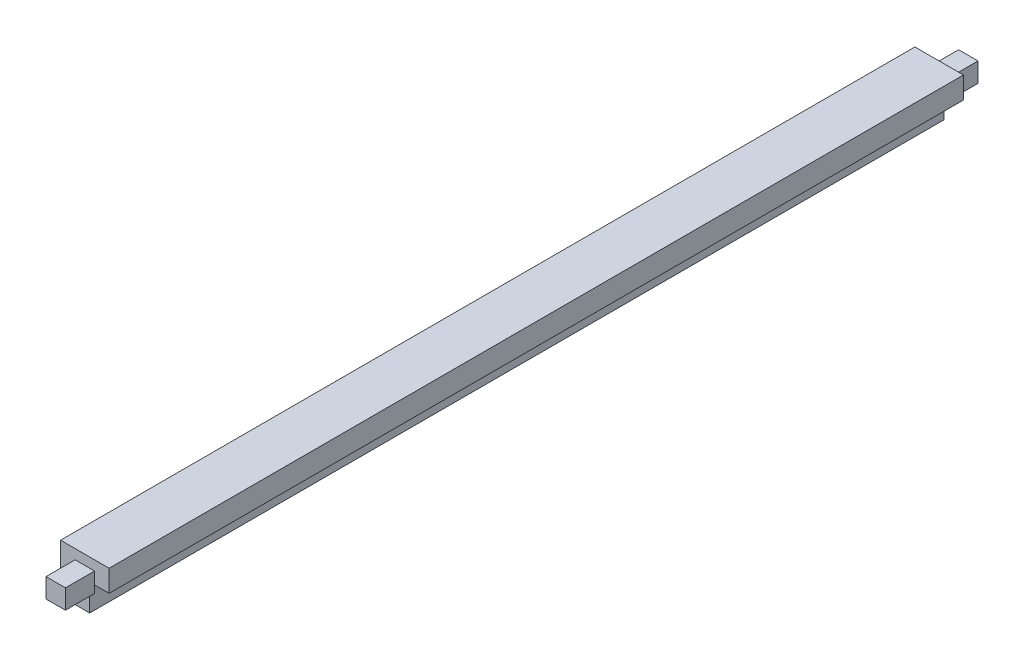
from build123d import *

# Parameters (mm, degrees)
SKETCH2_W           = 5
SKETCH2_H           = 88
BOSS_EXTRUDE1_DEPTH = 5
SKETCH6_W           = 2
SKETCH6_H           = 2
BOSS_EXTRUDE4_DEPTH = 3
SKETCH4_W           = 2
SKETCH4_H           = 2
BOSS_EXTRUDE3_DEPTH = 3
SKETCH5_W           = 2
SKETCH5_H           = 88
CUT_EXTRUDE2_DEPTH  = 2.762


with BuildPart() as part:
    # Sketch2 → Boss-Extrude1 (new body)
    with BuildSketch(Plane(origin=(0, 0, 0), x_dir=(1, 0, 0), z_dir=(0, 1, 0))):
        with Locations((-36.444928995, -11.927663992)):
            Rectangle(SKETCH2_W, SKETCH2_H)
    extrude(amount=BOSS_EXTRUDE1_DEPTH)

    # Sketch6 → Boss-Extrude4 (add)
    with BuildSketch(Plane.XY.offset(55.927663992)):
        with Locations((-36.444928995, 3)):
            Rectangle(SKETCH6_W, SKETCH6_H)
    extrude(amount=BOSS_EXTRUDE4_DEPTH)

    # Sketch4 → Boss-Extrude3 (add)
    with BuildSketch(Plane(origin=(0, 0, -32.072336008), x_dir=(-1, 0, 0), z_dir=(0, 0, -1))):
        with Locations((36.444928995, 3)):
            Rectangle(SKETCH4_W, SKETCH4_H)
    extrude(amount=BOSS_EXTRUDE3_DEPTH)

    # Sketch5 → Cut-Extrude2 (cut)
    with BuildSketch(Plane.XZ):
        with Locations((-34.944928995, 11.927663992)):
            Rectangle(SKETCH5_W, SKETCH5_H)
    extrude(amount=-CUT_EXTRUDE2_DEPTH, mode=Mode.SUBTRACT)


solid = part.part
